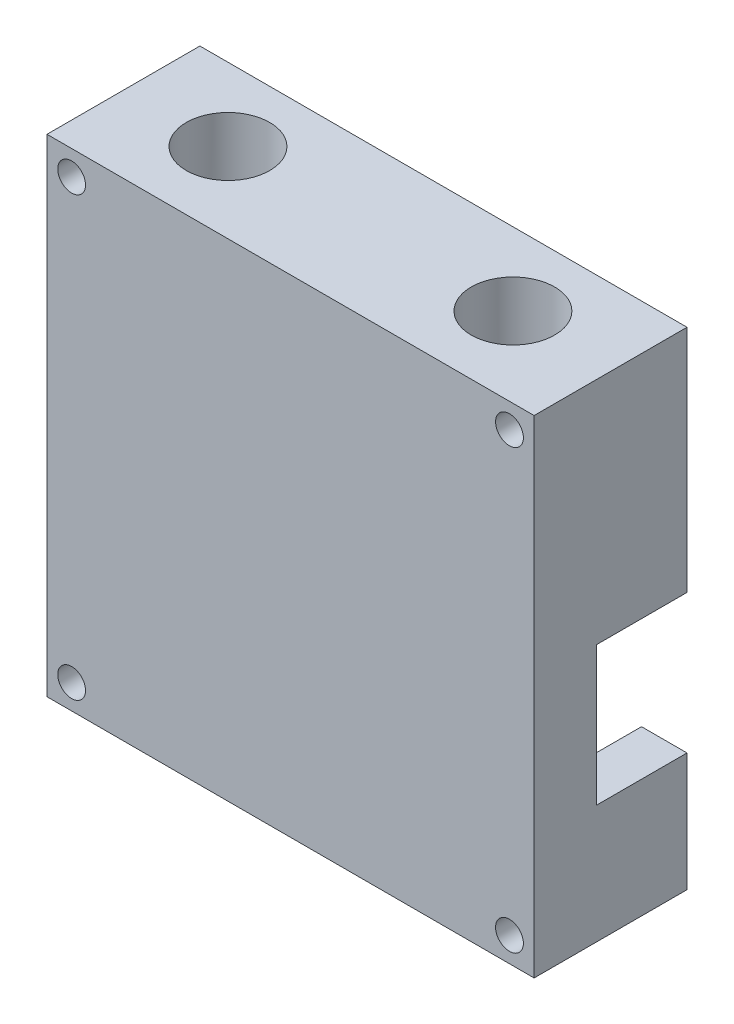
from build123d import *

# Parameters (mm, degrees)
SKETCH_1_W          = 70.091778518
SKETCH_1_H          = 70.091778518
SKETCH_1_R          = 2
EXTRUDE_1_DEPTH     = 22
CUT_EXTRUDE_4_DEPTH = 19
SKETCH_4_R          = 6
CUT_EXTRUDE_5_DEPTH = 15
SKETCH_4_3_R        = 6
CUT_EXTRUDE_6_DEPTH = 15
SKETCH_5_W          = 13
SKETCH_5_H          = 20
CUT_EXTRUDE_7_DEPTH = 10
SKETCH_6_W          = 57
SKETCH_6_H          = 13
CUT_EXTRUDE_8_DEPTH = 16


with BuildPart() as part:
    # 草图1 → 凸台-拉伸1 (new body)
    with BuildSketch(Plane.XY):
        Rectangle(SKETCH_1_W, SKETCH_1_H)
        with Locations((-31.5, -31.5)):
            Circle(SKETCH_1_R, mode=Mode.SUBTRACT)
        with Locations((-31.5, 31.5)):
            Circle(SKETCH_1_R, mode=Mode.SUBTRACT)
        with Locations((31.5, 31.5)):
            Circle(SKETCH_1_R, mode=Mode.SUBTRACT)
        with Locations((31.5, -31.5)):
            Circle(SKETCH_1_R, mode=Mode.SUBTRACT)
    extrude(amount=EXTRUDE_1_DEPTH)

    # 草图2 → 切除-拉伸4 (cut)
    with BuildSketch(Plane.XY):
        Polygon((-28.5, 25.5), (-13.5, 25.5), (-13.5, 29), (13.5, 29), (13.5, 25.5), (28.5, 25.5), (28.5, -27.6), (-28.5, -27.6), align=None)
    extrude(amount=CUT_EXTRUDE_4_DEPTH, mode=Mode.SUBTRACT)

    # 草图4 → 切除-拉伸5 (cut)
    with BuildSketch(Plane(origin=(0, 35.045889259, 0), x_dir=(1, 0, 0), z_dir=(0, 1, 0))):
        with Locations((20.5, -10.5)):
            Circle(SKETCH_4_R)
    extrude(amount=-CUT_EXTRUDE_5_DEPTH, mode=Mode.SUBTRACT)

    # 草图4<3> → 切除-拉伸6 (cut)
    with BuildSketch(Plane(origin=(0, 35.045889259, 0), x_dir=(1, 0, 0), z_dir=(0, 1, 0))):
        with Locations((20.5, -10.5)):
            Circle(SKETCH_4_3_R)
        with Locations((-20.5, -10.5)):
            Circle(SKETCH_4_3_R)
    extrude(amount=-CUT_EXTRUDE_6_DEPTH, mode=Mode.SUBTRACT)

    # 草图5 → 切除-拉伸7 (cut)
    with BuildSketch(Plane(origin=(35.045889259, 0, 0), x_dir=(0, 0, -1), z_dir=(1, 0, 0))):
        with Locations((-6.5, -8)):
            Rectangle(SKETCH_5_W, SKETCH_5_H)
    extrude(amount=-CUT_EXTRUDE_7_DEPTH, mode=Mode.SUBTRACT)

    # 草图6 → 切除-拉伸8 (cut)
    with BuildSketch(Plane(origin=(0, -35.045889259, 0), x_dir=(-1, 0, 0), z_dir=(0, -1, 0))):
        with Locations((0, -6.5)):
            Rectangle(SKETCH_6_W, SKETCH_6_H)
    extrude(amount=-CUT_EXTRUDE_8_DEPTH, mode=Mode.SUBTRACT)


solid = part.part
